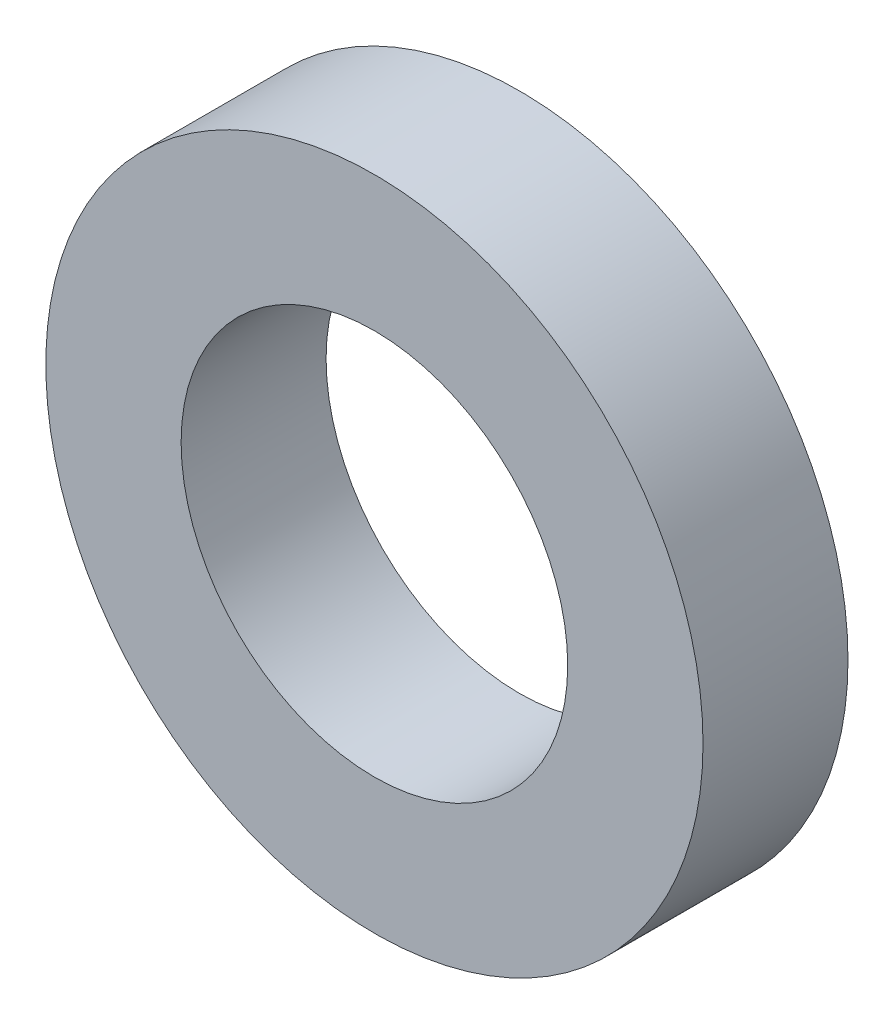
from build123d import *

# Parameters (mm, degrees)
SKETCH_1_R      = 34
SKETCH_1_R_2    = 20
EXTRUDE_1_DEPTH = 15


with BuildPart() as part:
    # 草图1 → 拉伸1 (new body)
    with BuildSketch(Plane.XY):
        Circle(SKETCH_1_R)
        Circle(SKETCH_1_R_2, mode=Mode.SUBTRACT)
    extrude(amount=EXTRUDE_1_DEPTH)


solid = part.part
